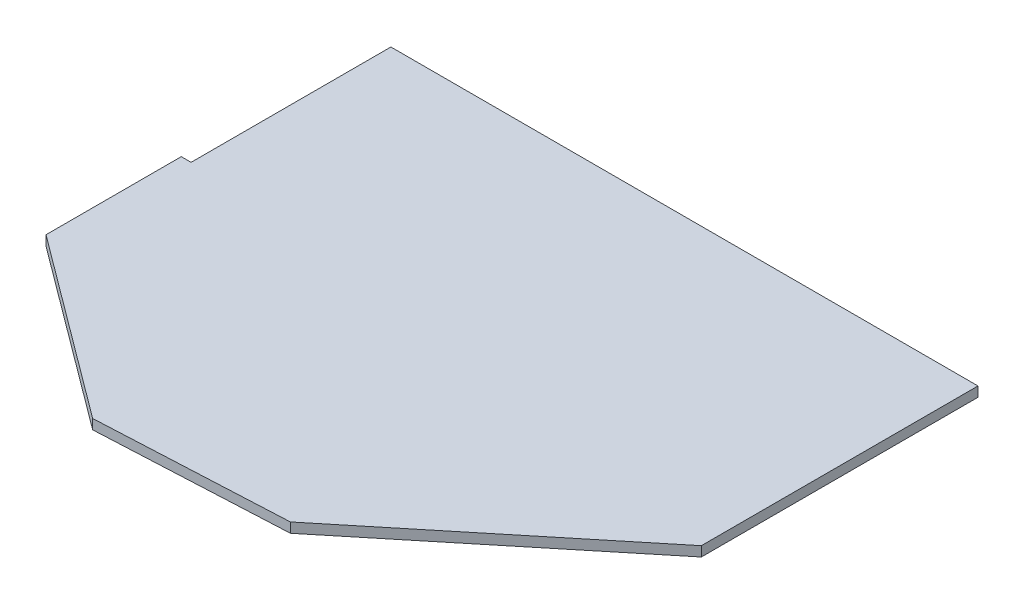
from build123d import *

# Parameters (mm, degrees)
BOSS_EXTRUDE1_DEPTH = 3.2
SKETCH3_R           = 12.3
BOSS_EXTRUDE2_DEPTH = 3.2
SKETCH4_R           = 4
BOSS_EXTRUDE3_DEPTH = 4


with BuildPart() as part:
    # Sketch1 → Boss-Extrude1 (new body)
    with BuildSketch(Plane(origin=(0, 0, 0), x_dir=(1, 0, 0), z_dir=(0, 1, 0))):
        Polygon((-71.199297972, 0), (119.800702028, 0), (119.800702028, -90), (46.272924854, -150.155348756), (-15.035731115, -153.181069815), (-74.399297972, -109), (-74.399297972, -65), (-71.199297972, -65), align=None)
    extrude(amount=BOSS_EXTRUDE1_DEPTH)

    # Sketch3 → Boss-Extrude2 (add)
    with BuildSketch(Plane.XZ):
        with Locations(Location((-5.399297972, 108.199281837, 0), (0, 0, 270))):
            Circle(SKETCH3_R)
    extrude(amount=BOSS_EXTRUDE2_DEPTH)

    # Sketch4 → Boss-Extrude3 (add)
    with BuildSketch(Plane.XZ.offset(3.2)):
        with Locations(Location((-5.399297972, 108.199281837, 0), (0, 0, 270))):
            Circle(SKETCH4_R)
    extrude(amount=BOSS_EXTRUDE3_DEPTH)


solid = part.part
